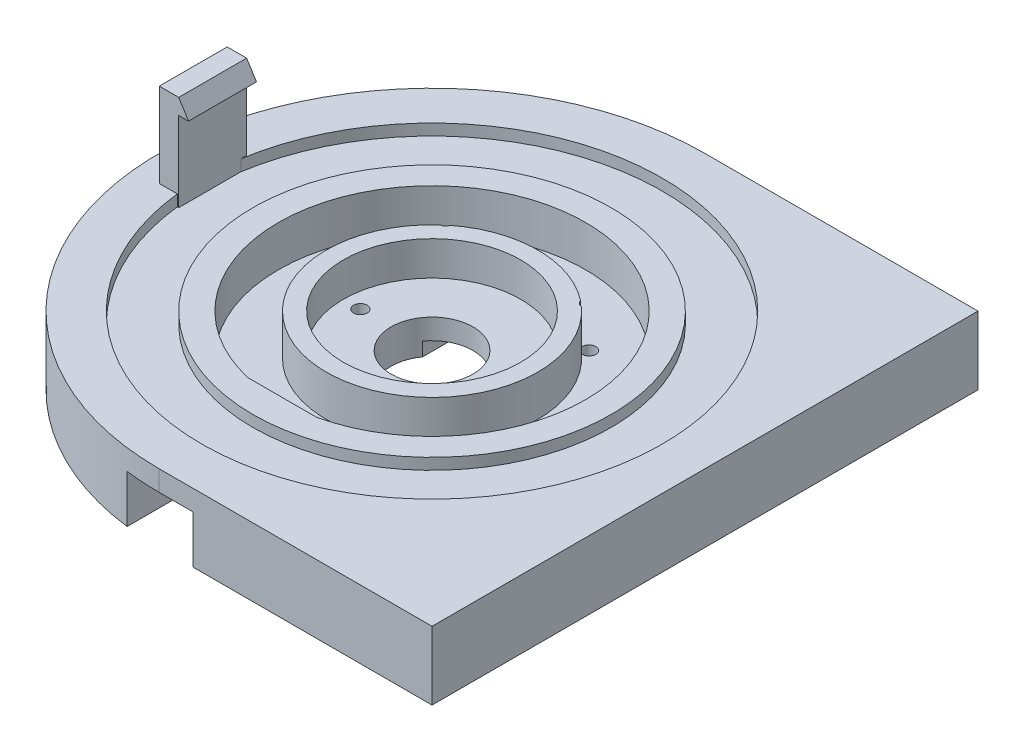
from build123d import *

# Parameters (mm, degrees)
SKETCH28_W                                   = 80
SKETCH28_H                                   = 80
BOSS_EXTRUDE1_DEPTH                          = 10
CBORE_FOR_M10_CHEESE_HEAD_SCREW1_D           = 12
CBORE_FOR_M10_CHEESE_HEAD_SCREW1_CBORE_D     = 26
CBORE_FOR_M10_CHEESE_HEAD_SCREW1_CBORE_DEPTH = 5
SKETCH37_R                                   = 22.5
SKETCH37_R_2                                 = 15.5
CUT_EXTRUDE2_DEPTH                           = 6
CUT_EXTRUDE6_DEPTH                           = 6
SKETCH40_W                                   = 18.062589032
SKETCH40_H                                   = 3
BOSS_EXTRUDE7_DEPTH                          = 13
SKETCH47_W                                   = 10
SKETCH47_H                                   = 9.031294516
CUT_EXTRUDE12_DEPTH                          = 10
SKETCH41_R                                   = 33.75
SKETCH41_R_2                                 = 26.25
CUT_EXTRUDE7_DEPTH                           = 1.65
SKETCH36_R                                   = 1
CUT_EXTRUDE13_DEPTH                          = 10
SKETCH42_W                                   = 9.8
SKETCH42_H                                   = 11.037342061
CUT_EXTRUDE8_DEPTH                           = 2
CUT_EXTRUDE11_DEPTH                          = 20
SKETCH45_W                                   = 2.851047628
SKETCH45_H                                   = 9.955339391
BOSS_EXTRUDE8_DEPTH                          = 14
BOSS_EXTRUDE9_START                          = -9.955339
BOSS_EXTRUDE9_DEPTH                          = 9.955339


with BuildPart() as part:
    # Sketch28 → Boss-Extrude1 (new body)
    with BuildSketch(Plane(origin=(0, 0, 0), x_dir=(1, 0, 0), z_dir=(0, 1, 0))):
        with Locations((1.944585414, 4.241283073)):
            Rectangle(SKETCH28_W, SKETCH28_H)
    extrude(amount=BOSS_EXTRUDE1_DEPTH)

    # CBORE for M10 Cheese Head Screw1 (through all)
    with Locations(Plane(origin=(0, 10, 0), x_dir=(1, 0, 0), z_dir=(0, 1, 0))):
        with Locations((1.944585414, 4.241283073)):
            CounterBoreHole(CBORE_FOR_M10_CHEESE_HEAD_SCREW1_D / 2, CBORE_FOR_M10_CHEESE_HEAD_SCREW1_CBORE_D / 2, CBORE_FOR_M10_CHEESE_HEAD_SCREW1_CBORE_DEPTH)

    # Sketch37 → Cut-Extrude2 (cut)
    with BuildSketch(Plane(origin=(0, 10, 0), x_dir=(1, 0, 0), z_dir=(0, 1, 0))):
        with Locations(Location((1.944585414, 4.241283073, 0), (0, 0, 270))):
            Circle(SKETCH37_R)
        with Locations(Location((1.944585414, 4.241283073, 0), (0, 0, 270))):
            Circle(SKETCH37_R_2, mode=Mode.SUBTRACT)
    extrude(amount=-CUT_EXTRUDE2_DEPTH, mode=Mode.SUBTRACT)

    # Sketch39 → Cut-Extrude6 (cut)
    with BuildSketch(Plane(origin=(0, 10, 0), x_dir=(1, 0, 0), z_dir=(0, 1, 0))):
        with BuildLine():
            Line((6.944585414, -35.758716927), (6.944585414, -17.696127895))
            ThreePointArc((6.944585414, -17.696127895), (1.944585414, -18.258716927), (-3.055414586, -17.696127895))
            Line((-3.055414586, -17.696127895), (-3.055414586, -35.758716927))
            Line((-3.055414586, -35.758716927), (1.944585414, -35.758716927))
            Line((1.944585414, -35.758716927), (6.944585414, -35.758716927))
        make_face()
    extrude(amount=-CUT_EXTRUDE6_DEPTH, mode=Mode.SUBTRACT)

    # Sketch40 → Boss-Extrude7 (add)
    with BuildSketch(Plane(origin=(-3.055414586, 0, 0), x_dir=(0, 0, -1), z_dir=(1, 0, 0))):
        with Locations((-26.727422411, 8.5)):
            Rectangle(SKETCH40_W, SKETCH40_H)
    extrude(amount=BOSS_EXTRUDE7_DEPTH)

    # Sketch47 → Cut-Extrude12 (cut)
    with BuildSketch(Plane(origin=(0, 4, 0), x_dir=(1, 0, 0), z_dir=(0, 1, 0))):
        with Locations((1.944585414, -31.243069669)):
            Rectangle(SKETCH47_W, SKETCH47_H)
    extrude(amount=-CUT_EXTRUDE12_DEPTH, mode=Mode.SUBTRACT)

    # Sketch41 → Cut-Extrude7 (cut)
    with BuildSketch(Plane(origin=(0, 10, 0), x_dir=(1, 0, 0), z_dir=(0, 1, 0))):
        with Locations(Location((1.944585414, 4.241283073, 0), (0, 0, 270))):
            Circle(SKETCH41_R)
        with Locations(Location((1.944585414, 4.241283073, 0), (0, 0, 270))):
            Circle(SKETCH41_R_2, mode=Mode.SUBTRACT)
    extrude(amount=-CUT_EXTRUDE7_DEPTH, mode=Mode.SUBTRACT)

    # Sketch36 → Cut-Extrude13 (cut)
    with BuildSketch(Plane.XZ):
        with Locations(Location((12.444585414, -16.741283073, 0), (0, 0, 270))):
            Circle(SKETCH36_R)
        with Locations(Location((12.444585414, -4.241283073, 0), (0, 0, 270))):
            Circle(SKETCH36_R)
        with Locations(Location((-8.555414586, -16.741283073, 0), (0, 0, 16.545854879))):
            Circle(SKETCH36_R)
        with Locations(Location((-8.555414586, -4.241283073, 0), (0, 0, 270))):
            Circle(SKETCH36_R)
    extrude(amount=-CUT_EXTRUDE13_DEPTH, mode=Mode.SUBTRACT)

    # Sketch42 → Cut-Extrude8 (cut)
    with BuildSketch(Plane.XZ):
        with Locations((1.966640169, -13.109663986)):
            Rectangle(SKETCH42_W, SKETCH42_H)
    extrude(amount=-CUT_EXTRUDE8_DEPTH, mode=Mode.SUBTRACT)

    # Sketch43 → Cut-Extrude11 (cut)
    with BuildSketch(Plane(origin=(0, 10, 0), x_dir=(1, 0, 0), z_dir=(0, 1, 0))):
        with BuildLine():
            ThreePointArc((-38.055414586, 4.241282966), (-26.339685871, 32.525554283), (1.944585414, 44.241283073))
            Line((1.944585414, 44.241283073), (-38.055414586, 44.241283073))
            Line((-38.055414586, 44.241283073), (-38.055414586, 4.241282966))
        make_face()
        with BuildLine():
            ThreePointArc((1.944585414, -35.758716927), (-26.339685795, -24.042988212), (-38.055414586, 4.241282966))
            Line((-38.055414586, 4.241282966), (-38.055414586, -35.758716927))
            Line((-38.055414586, -35.758716927), (1.944585414, -35.758716927))
        make_face()
    extrude(amount=-CUT_EXTRUDE11_DEPTH, mode=Mode.SUBTRACT)

    # Sketch45 → Boss-Extrude8 (add)
    with BuildSketch(Plane(origin=(0, 8.35, 0), x_dir=(1, 0, 0), z_dir=(0, 1, 0))):
        with Locations((-32.810971356, 5.43037333)):
            Rectangle(SKETCH45_W, SKETCH45_H)
    extrude(amount=BOSS_EXTRUDE8_DEPTH)

    # Sketch46 → Boss-Extrude9 (add)
    with BuildSketch(Plane.XY.offset(-0.452703634).offset(BOSS_EXTRUDE9_START)):
        Polygon((-31.385447542, 22.35), (-31.385447542, 20.057188555), (-29.944471524, 20.057188555), align=None)
    extrude(amount=BOSS_EXTRUDE9_DEPTH)


solid = part.part
